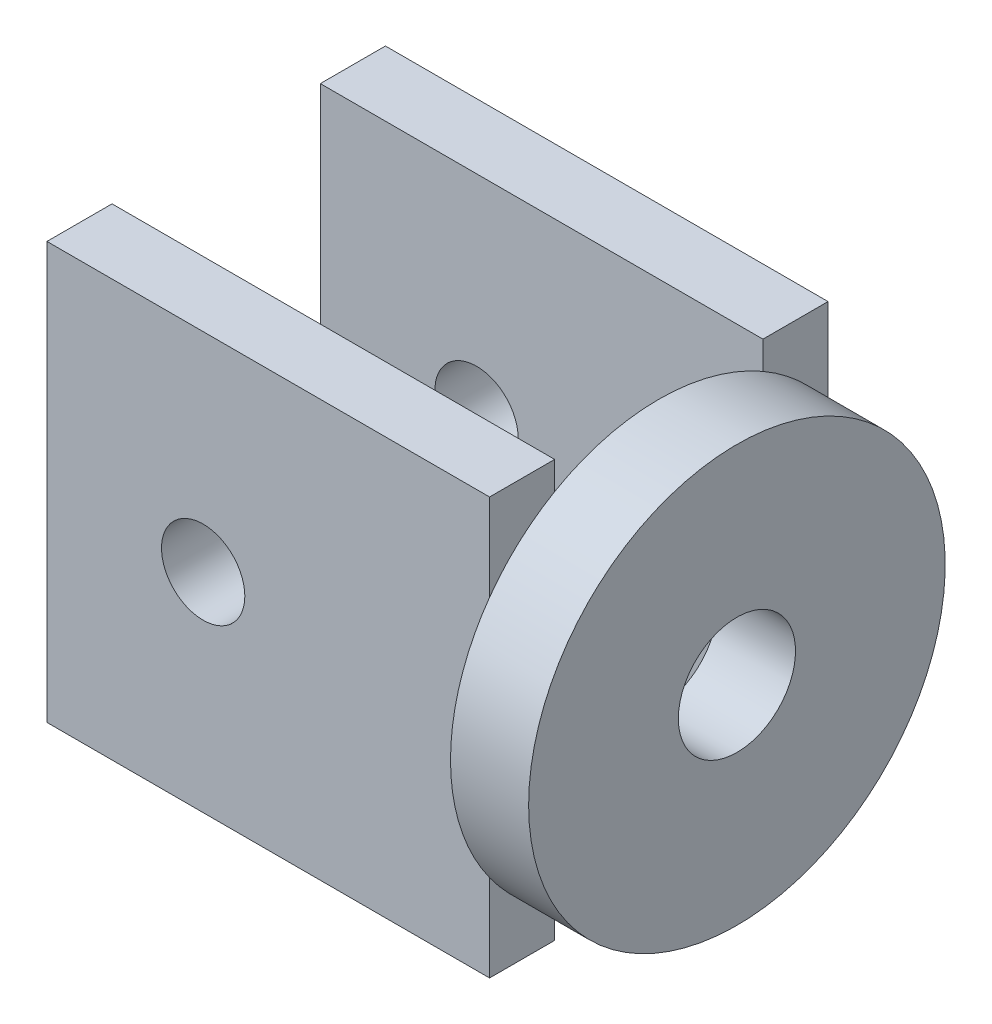
from build123d import *

# Parameters (mm, degrees)
BASE_SKETCH_W        = 3
BASE_SKETCH_H        = 8
CHEEK_BLOCK_SKETCH_W = 17
CHEEK_BLOCK_SKETCH_H = 16
CHEEK_BLOCK_DEPTH    = 6.5
GAP_SKETCH_W         = 18
GAP_SKETCH_H         = 18
GAP_DEPTH            = 4
PIN_HOLE_SKETCH_R    = 1.6
PIN_HOLE_DEPTH       = 8.5
SCREW_HOLE_SKETCH_W  = 4
SCREW_HOLE_SKETCH_H  = 2.25


with BuildPart() as part:
    # Base Sketch → Base (revolve)
    with BuildSketch(Plane.XY):
        with Locations((-1.5, 4)):
            Rectangle(BASE_SKETCH_W, BASE_SKETCH_H)
    revolve(axis=Axis((-3000, 0, 0), (1, 0, 0)))

    # Cheek Block Sketch → Cheek Block (add, symmetric)
    with BuildSketch(Plane.XY):
        with Locations((-11.5, 0)):
            Rectangle(CHEEK_BLOCK_SKETCH_W, CHEEK_BLOCK_SKETCH_H)
    extrude(amount=CHEEK_BLOCK_DEPTH, both=True)

    # Gap Sketch → Gap (cut, symmetric)
    with BuildSketch(Plane.XY):
        with Locations((-12, 0)):
            Rectangle(GAP_SKETCH_W, GAP_SKETCH_H)
    extrude(amount=GAP_DEPTH, both=True, mode=Mode.SUBTRACT)

    # Pin Hole Sketch → Pin Hole (cut, symmetric)
    with BuildSketch(Plane.XY):
        with Locations((-14, 0)):
            Circle(PIN_HOLE_SKETCH_R)
    extrude(amount=PIN_HOLE_DEPTH, both=True, mode=Mode.SUBTRACT)

    # Screw Hole Sketch → Screw Hole (revolve, cut)
    with BuildSketch(Plane.XY):
        with Locations((-1.5, 1.125)):
            Rectangle(SCREW_HOLE_SKETCH_W, SCREW_HOLE_SKETCH_H)
    revolve(axis=Axis((-3000, 0, 0), (1, 0, 0)), mode=Mode.SUBTRACT)


solid = part.part
